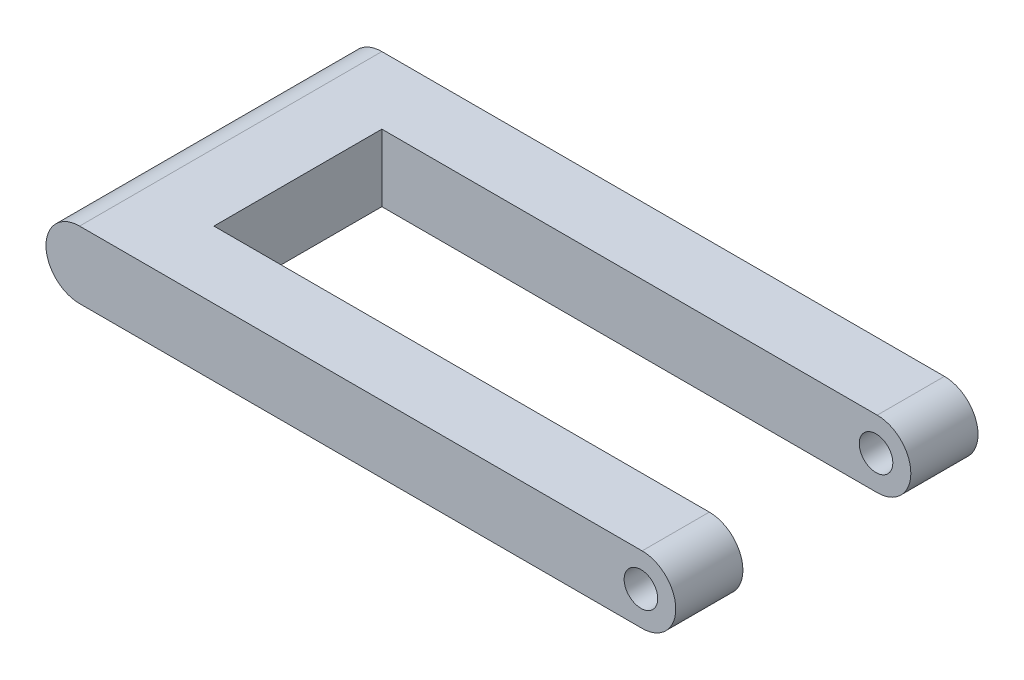
from build123d import *

# Parameters (mm, degrees)
BOSS_EXTRUDE1_DEPTH = 4
BOSS_EXTRUDE2_DEPTH = 10
BOSS_EXTRUDE3_DEPTH = 4
SKETCH4_R           = 1
CUT_EXTRUDE4_DEPTH  = 26


with BuildPart() as part:
    # Sketch1 → Boss-Extrude1 (new body)
    with BuildSketch(Plane.XY):
        with BuildLine():
            Line((0, 0), (33.5, 0))
            ThreePointArc((33.5, 0), (35.5, 2), (33.5, 4))
            Line((33.5, 4), (0, 4))
            ThreePointArc((0, 4), (-2, 2), (0, 0))
        make_face()
    extrude(amount=BOSS_EXTRUDE1_DEPTH)

    # Sketch2 → Boss-Extrude2 (add)
    with BuildSketch(Plane.XY.offset(4)):
        with BuildLine():
            Line((4, 0), (0, 0))
            ThreePointArc((0, 0), (-2, 2), (0, 4))
            Line((0, 4), (4, 4))
            Line((4, 4), (4, 0))
        make_face()
    extrude(amount=BOSS_EXTRUDE2_DEPTH)

    # Sketch3 → Boss-Extrude3 (add)
    with BuildSketch(Plane.XY.offset(14)):
        with BuildLine():
            Line((0, 4), (33.5, 4))
            ThreePointArc((33.5, 4), (35.5, 2), (33.5, 0))
            Line((33.5, 0), (0, 0))
            ThreePointArc((0, 0), (-2, 2), (0, 4))
        make_face()
    extrude(amount=BOSS_EXTRUDE3_DEPTH)

    # Sketch4 → Cut-Extrude4 (cut)
    with BuildSketch(Plane.XY.offset(18)):
        with Locations((33.427257806, 2)):
            Circle(SKETCH4_R)
    extrude(amount=-CUT_EXTRUDE4_DEPTH, mode=Mode.SUBTRACT)


solid = part.part
